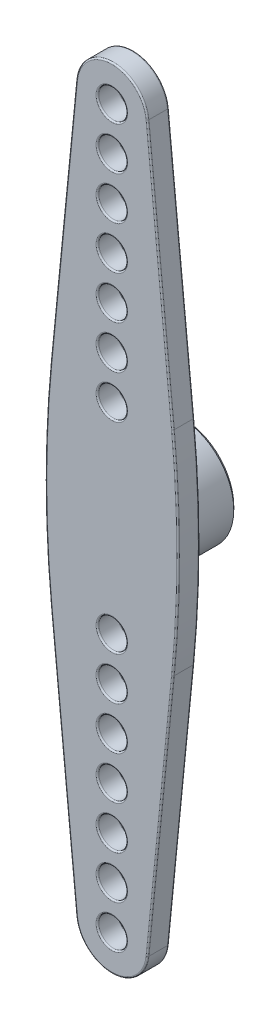
from build123d import *

# Parameters (mm, degrees)
SKETCH1_R           = 1
BOSS_EXTRUDE1_DEPTH = 1.5
FILLET1_R           = 75
SKETCH2_R           = 3.75
SKETCH2_R_2         = 1
EXTRUDE_THIN1_DEPTH = 3.5
CHAMFER1_SIZE       = 0.25
FILLET2_R           = 0.1


with BuildPart() as part:
    # Sketch1 → Boss-Extrude1 (new body)
    with BuildSketch(Plane.XY):
        with BuildLine():
            Line((-5, 0), (-2.487714319, 25.247542864))
            ThreePointArc((-2.487714319, 25.247542864), (0, 27.5), (2.487714319, 25.247542864))
            Line((2.487714319, 25.247542864), (5, 0))
            Line((5, 0), (2.487714319, -25.247542864))
            ThreePointArc((2.487714319, -25.247542864), (0, -27.5), (-2.487714319, -25.247542864))
            Line((-2.487714319, -25.247542864), (-5, 0))
        make_face()
        with Locations((0, 25)):
            Circle(SKETCH1_R, mode=Mode.SUBTRACT)
        with Locations((0, 22)):
            Circle(SKETCH1_R, mode=Mode.SUBTRACT)
        with Locations((0, 19)):
            Circle(SKETCH1_R, mode=Mode.SUBTRACT)
        with Locations((0, 16)):
            Circle(SKETCH1_R, mode=Mode.SUBTRACT)
        with Locations((0, 13)):
            Circle(SKETCH1_R, mode=Mode.SUBTRACT)
        with Locations((0, 10)):
            Circle(SKETCH1_R, mode=Mode.SUBTRACT)
        with Locations((0, 7)):
            Circle(SKETCH1_R, mode=Mode.SUBTRACT)
        with Locations(Location((0, -7, 0), (0, 0, 180))):
            Circle(SKETCH1_R, mode=Mode.SUBTRACT)
        with Locations(Location((0, -10, 0), (0, 0, 180))):
            Circle(SKETCH1_R, mode=Mode.SUBTRACT)
        with Locations(Location((0, -13, 0), (0, 0, 180))):
            Circle(SKETCH1_R, mode=Mode.SUBTRACT)
        with Locations(Location((0, -16, 0), (0, 0, 180))):
            Circle(SKETCH1_R, mode=Mode.SUBTRACT)
        with Locations(Location((0, -19, 0), (0, 0, 180))):
            Circle(SKETCH1_R, mode=Mode.SUBTRACT)
        with Locations(Location((0, -22, 0), (0, 0, 180))):
            Circle(SKETCH1_R, mode=Mode.SUBTRACT)
        with Locations(Location((0, -25, 0), (0, 0, 180))):
            Circle(SKETCH1_R, mode=Mode.SUBTRACT)
    extrude(amount=BOSS_EXTRUDE1_DEPTH)

    # Fillet1
    fillet1_edges = [part.edges().sort_by_distance(p)[0] for p in [
        (-5, 0, 0.75),
        (5, 0, 0.75),
    ]]
    fillet(fillet1_edges, radius=FILLET1_R)

    # Sketch2 → Extrude-Thin1 (add)
    with BuildSketch(Plane(origin=(0, 0, 0), x_dir=(-1, 0, 0), z_dir=(0, 0, -1))):
        Circle(SKETCH2_R)
        Circle(SKETCH2_R_2, mode=Mode.SUBTRACT)
    extrude(amount=EXTRUDE_THIN1_DEPTH)

    # Chamfer1
    chamfer1_edges = [part.edges().sort_by_distance(p)[0] for p in [
        (3.75, 0, -3.5),
        (1, 0, -3.5),
    ]]
    chamfer(chamfer1_edges, length=CHAMFER1_SIZE)

    # Fillet2
    fillet2_edges = [part.edges().sort_by_distance(p)[0] for p in [
        (3.374376615, -16.336914387, 1.5),
        (-1, 25, 0),
        (-1, 25, 1.5),
        (-1, 22, 0),
        (0, 27.5, 1.5),
        (-1, 22, 1.5),
        (-1, 19, 0),
        (-3.374376615, 16.336914387, 1.5),
        (-1, 19, 1.5),
        (-1, 16, 0),
        (-1, 16, 1.5),
        (-1, 13, 0),
        (-1, 13, 1.5),
        (-1, 10, 0),
        (-1, 10, 1.5),
        (-1, 7, 0),
        (-1, 7, 1.5),
        (1, -7, 0),
        (1, -7, 1.5),
        (1, -10, 0),
        (1, -10, 1.5),
        (1, -13, 0),
        (1, -13, 1.5),
        (1, -16, 0),
        (1, -16, 1.5),
        (1, -19, 0),
        (1, -19, 1.5),
        (1, -22, 0),
        (1, -22, 1.5),
        (1, -25, 0),
        (1, -25, 1.5),
        (-3.374376615, 16.336914387, 0),
        (0, 27.5, 0),
        (-3.374376615, -16.336914387, 0),
        (-3.374376615, -16.336914387, 1.5),
        (3.374376615, 16.336914387, 0),
        (4.629609355, 0, 0),
        (-4.629609355, 0, 0),
        (3.374376615, -16.336914387, 0),
        (3.374376615, 16.336914387, 1.5),
        (4.629609355, 0, 1.5),
        (-4.629609355, 0, 1.5),
        (0, -27.5, 0),
        (0, -27.5, 1.5),
        (3.75, 0, 0),
    ]]
    fillet(fillet2_edges, radius=FILLET2_R)


solid = part.part
